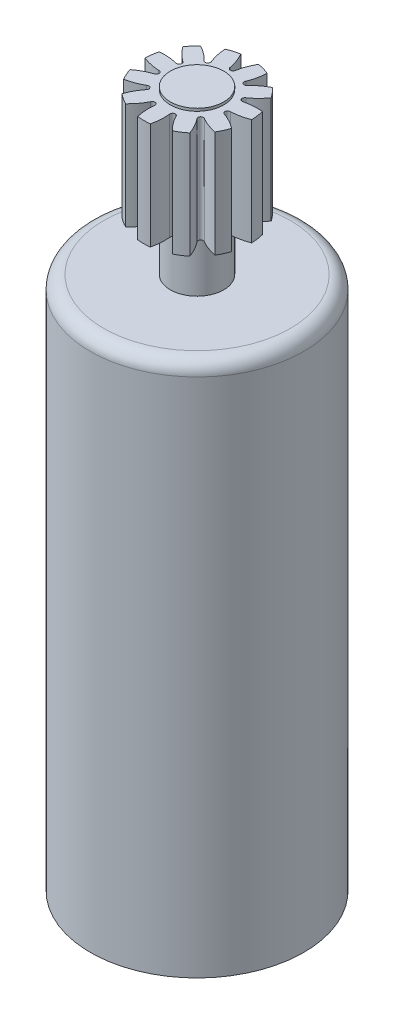
from build123d import *

# Parameters (mm, degrees)
CUT_EXTRUDE2_START = -5
CUT_EXTRUDE2_DEPTH = 5
CIRPATTERN1_COUNT  = 11


with BuildPart() as part:
    # Sketch4 → Revolve1 (revolve)
    with BuildSketch(Plane(origin=(0, 0, 0), x_dir=(0, 0, -1), z_dir=(1, 0, 0))):
        with BuildLine():
            Line((0, 0), (0, 26.1))
            Line((0, 26.1), (1, 26.1))
            Line((1, 26.1), (1, 26))
            Line((1, 26), (2, 26))
            Line((2, 26), (2, 22))
            Line((2, 22), (1, 22))
            Line((1, 22), (1, 20))
            Line((1, 20), (3.5, 20))
            ThreePointArc((3.5, 20), (3.853553391, 19.853553391), (4, 19.5))
            Line((4, 19.5), (4, 0))
            Line((4, 0), (0, 0))
        make_face()
    revolve(axis=Axis((0, 0, 0), (0, 1, 0)))

    # Sketch5 → Cut-Extrude2 (cut)
    with BuildSketch(Plane(origin=(0, 26, 0), x_dir=(1, 0, 0), z_dir=(0, 1, 0)).offset(CUT_EXTRUDE2_START)):
        with BuildLine():
            ThreePointArc((0.332507409, 1.972166023), (0.190245846, 1.670802314), (0.1, 1.35))
            ThreePointArc((0.1, 1.35), (0, 1.25), (-0.1, 1.35))
            ThreePointArc((-0.1, 1.35), (-0.190245846, 1.670802314), (-0.332507409, 1.972166023))
            ThreePointArc((-0.332507409, 1.972166023), (0, 2), (0.332507409, 1.972166023))
        make_face()
    cut_extrude2 = extrude(amount=CUT_EXTRUDE2_DEPTH, mode=Mode.SUBTRACT)

    # CirPattern1: Cut-Extrude2 ×11 about axis
    cirpattern1_axis = Axis((0, 0, 0), (0, 1, 0))
    for i in range(1, CIRPATTERN1_COUNT):
        add(cut_extrude2.rotate(cirpattern1_axis, i * 360 / CIRPATTERN1_COUNT), mode=Mode.SUBTRACT)


solid = part.part
